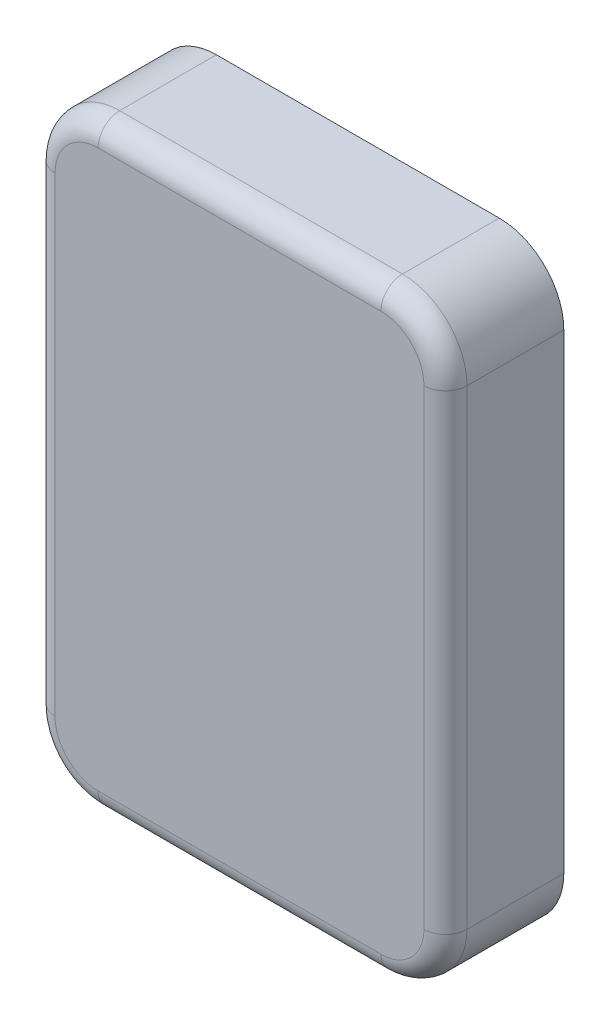
from build123d import *

# Parameters (mm, degrees)
BOSS_EXTRUDE1_DEPTH = 8
SKETCH12_W          = 1.5
SKETCH12_H          = 8.6
BOSS_EXTRUDE8_DEPTH = 3
BOSS_EXTRUDE5_DEPTH = 3
BOSS_EXTRUDE6_START = 8.75
SKETCH10_R          = 1.75
BOSS_EXTRUDE6_DEPTH = 8.75
SKETCH11_W          = 14.1
SKETCH11_H          = 1.5
BOSS_EXTRUDE7_DEPTH = 1.5
FILLET1_R           = 2
CUT_EXTRUDE2_REACH  = 69.432
SKETCH13_W          = 14
SKETCH13_H          = 7.25
FILLET2_R           = 1
SKETCH14_W          = 11
SKETCH14_H          = 52.76
CUT_EXTRUDE3_DEPTH  = 1
SKETCH15_W          = 5.5
SKETCH15_H          = 50.26
CUT_EXTRUDE4_DEPTH  = 1.5
SKETCH17_W          = 4
SKETCH17_H          = 5
SKETCH17_R          = 1
BOSS_EXTRUDE9_DEPTH = 1


with BuildPart() as part:
    # Sketch1 → Boss-Extrude1 (new body)
    with BuildSketch(Plane.XY):
        with BuildLine():
            Line((-0.5, 27.44), (-0.5, 0.5))
            ThreePointArc((-0.5, 0.5), (0.818019485, -2.681980515), (4, -4))
            Line((4, -4), (30.29, -4))
            ThreePointArc((30.29, -4), (33.471980515, -2.681980515), (34.79, 0.5))
            Line((34.79, 0.5), (34.79, 44.26))
            ThreePointArc((34.79, 44.26), (33.471980515, 47.441980515), (30.29, 48.76))
            Line((30.29, 48.76), (4, 48.76))
            ThreePointArc((4, 48.76), (0.818019485, 47.441980515), (-0.5, 44.26))
            Line((-0.5, 44.26), (-0.5, 36.04))
            Line((-0.5, 36.04), (-2, 36.04))
            Line((-2, 36.04), (-2, 44.26))
            ThreePointArc((-2, 44.26), (-0.242640687, 48.502640687), (4, 50.26))
            Line((4, 50.26), (30.29, 50.26))
            ThreePointArc((30.29, 50.26), (34.532640687, 48.502640687), (36.29, 44.26))
            Line((36.29, 44.26), (36.29, 0.5))
            ThreePointArc((36.29, 0.5), (34.532640687, -3.742640687), (30.29, -5.5))
            Line((30.29, -5.5), (4, -5.5))
            ThreePointArc((4, -5.5), (-0.242640687, -3.742640687), (-2, 0.5))
            Line((-2, 0.5), (-2, 27.44))
            Line((-2, 27.44), (-0.5, 27.44))
        make_face()
    extrude(amount=BOSS_EXTRUDE1_DEPTH)

    # Sketch12 → Boss-Extrude8 (add)
    with BuildSketch(Plane.XY.offset(8)):
        with Locations((-1.25, 31.74)):
            Rectangle(SKETCH12_W, SKETCH12_H)
    extrude(amount=-BOSS_EXTRUDE8_DEPTH)

    # Sketch8 → Boss-Extrude5 (add)
    with BuildSketch(Plane.XY.offset(8)):
        with BuildLine():
            Line((-2, 44.26), (-2, 0.5))
            ThreePointArc((-2, 0.5), (-0.242640687, -3.742640687), (4, -5.5))
            Line((4, -5.5), (30.29, -5.5))
            ThreePointArc((30.29, -5.5), (34.532640687, -3.742640687), (36.29, 0.5))
            Line((36.29, 0.5), (36.29, 44.26))
            ThreePointArc((36.29, 44.26), (34.532640687, 48.502640687), (30.29, 50.26))
            Line((30.29, 50.26), (4, 50.26))
            ThreePointArc((4, 50.26), (-0.242640687, 48.502640687), (-2, 44.26))
        make_face()
    extrude(amount=BOSS_EXTRUDE5_DEPTH)

    # Sketch10 → Boss-Extrude6 (add)
    # profile 1 of 4: a face of its own
    with BuildSketch(Plane(origin=(0, 0, 8), x_dir=(-1, 0, 0), z_dir=(0, 0, -1)).offset(BOSS_EXTRUDE6_START)):
        with BuildLine():
            Line((-30.29, 48.76), (-26.73, 48.76))
            Line((-26.73, 48.76), (-26.73, 44.45))
            ThreePointArc((-26.73, 44.45), (-27.828349571, 41.798349571), (-30.48, 40.7))
            Line((-30.48, 40.7), (-34.79, 40.7))
            Line((-34.79, 40.7), (-34.79, 44.26))
            ThreePointArc((-34.79, 44.26), (-33.471980515, 47.441980515), (-30.29, 48.76))
        make_face()
        with Locations(Location((-30.48, 44.45, 0), (0, 0, 180))):
            Circle(SKETCH10_R, mode=Mode.SUBTRACT)
    # profile 2 of 4: a face of its own
    with BuildSketch(Plane(origin=(0, 0, 8), x_dir=(-1, 0, 0), z_dir=(0, 0, -1)).offset(BOSS_EXTRUDE6_START)):
        with BuildLine():
            Line((-3.81, 40.7), (0.5, 40.7))
            Line((0.5, 40.7), (0.5, 44.26))
            ThreePointArc((0.5, 44.26), (-0.818019485, 47.441980515), (-4, 48.76))
            Line((-4, 48.76), (-7.56, 48.76))
            Line((-7.56, 48.76), (-7.56, 44.45))
            ThreePointArc((-7.56, 44.45), (-6.461650429, 41.798349571), (-3.81, 40.7))
        make_face()
        with Locations(Location((-3.81, 44.45, 0), (0, 0, 180))):
            Circle(SKETCH10_R, mode=Mode.SUBTRACT)
    # profile 3 of 4: a face of its own
    with BuildSketch(Plane(origin=(0, 0, 8), x_dir=(-1, 0, 0), z_dir=(0, 0, -1)).offset(BOSS_EXTRUDE6_START)):
        with BuildLine():
            Line((0.5, 7.56), (0.5, 0.5))
            ThreePointArc((0.5, 0.5), (-0.818019485, -2.681980515), (-4, -4))
            Line((-4, -4), (-7.56, -4))
            Line((-7.56, -4), (-7.56, 3.81))
            ThreePointArc((-7.56, 3.81), (-6.461650429, 6.461650429), (-3.81, 7.56))
            Line((-3.81, 7.56), (0.5, 7.56))
        make_face()
        with Locations(Location((-3.81, 3.81, 0), (0, 0, 180))):
            Circle(SKETCH10_R, mode=Mode.SUBTRACT)
    # profile 4 of 4: a face of its own
    with BuildSketch(Plane(origin=(0, 0, 8), x_dir=(-1, 0, 0), z_dir=(0, 0, -1)).offset(BOSS_EXTRUDE6_START)):
        with BuildLine():
            Line((-26.73, -4), (-30.29, -4))
            ThreePointArc((-30.29, -4), (-33.471980515, -2.681980515), (-34.79, 0.5))
            Line((-34.79, 0.5), (-34.79, 7.56))
            Line((-34.79, 7.56), (-30.48, 7.56))
            ThreePointArc((-30.48, 7.56), (-27.828349571, 6.461650429), (-26.73, 3.81))
            Line((-26.73, 3.81), (-26.73, -4))
        make_face()
        with Locations(Location((-30.48, 3.81, 0), (0, 0, 180))):
            Circle(SKETCH10_R, mode=Mode.SUBTRACT)
    extrude(amount=-BOSS_EXTRUDE6_DEPTH)

    # Sketch11 → Boss-Extrude7 (add)
    with BuildSketch(Plane(origin=(0, 0, 8), x_dir=(-1, 0, 0), z_dir=(0, 0, -1))):
        with Locations((-17.145, -4.75)):
            Rectangle(SKETCH11_W, SKETCH11_H)
    extrude(amount=BOSS_EXTRUDE7_DEPTH)

    # Fillet1
    fillet1_edges = [part.edges().sort_by_distance(p)[0] for p in [
        (17.145, -5.5, 11),
        (36.29, 22.38, 11),
        (34.532640687, 48.502640687, 11),
        (17.145, 50.26, 11),
        (-0.242640687, 48.502640687, 11),
        (-2, 22.38, 11),
        (-0.242640687, -3.742640687, 11),
        (34.532640687, -3.742640687, 11),
    ]]
    fillet(fillet1_edges, radius=FILLET1_R)

    # Sketch13 → Cut-Extrude2 (cut, up to next)
    with BuildSketch(Plane.XZ.offset(5.5), mode=Mode.PRIVATE) as cut_extrude2_sk1:
        with Locations((17.145, 3.625)):
            Rectangle(SKETCH13_W, SKETCH13_H)
    cut_extrude2_tool1 = extrude(cut_extrude2_sk1.sketch, amount=-CUT_EXTRUDE2_REACH, mode=Mode.PRIVATE) & part.part
    add(cut_extrude2_tool1.solids().sort_by_distance((17.145, -5.5, 3.625))[0], mode=Mode.SUBTRACT)

    # Fillet2
    fillet2_edges = [part.edges().sort_by_distance(p)[0] for p in [
        (-1.25, 36.04, 5),
        (-1.25, 27.44, 5),
        (10.145, -4.75, 7.25),
        (24.145, -4.75, 7.25),
    ]]
    fillet(fillet2_edges, radius=FILLET2_R)

    # Sketch14 → Cut-Extrude3 (cut)
    with BuildSketch(Plane(origin=(0, 0, 8), x_dir=(-1, 0, 0), z_dir=(0, 0, -1))):
        with Locations((-17.145, 22.38)):
            Rectangle(SKETCH14_W, SKETCH14_H)
    extrude(amount=-CUT_EXTRUDE3_DEPTH, mode=Mode.SUBTRACT)

    # Sketch15 → Cut-Extrude4 (cut)
    with BuildSketch(Plane(origin=(0, 0, 9), x_dir=(-1, 0, 0), z_dir=(0, 0, -1))):
        with Locations((-15.895, 22.38)):
            Rectangle(SKETCH15_W, SKETCH15_H)
    extrude(amount=-CUT_EXTRUDE4_DEPTH, mode=Mode.SUBTRACT)

    # Sketch17 → Boss-Extrude9 (add)
    # profile 1 of 2: a face of its own
    with BuildSketch(Plane(origin=(0, 0, 9), x_dir=(-1, 0, 0), z_dir=(0, 0, -1))):
        with Locations((-20.645, 9.86)):
            Rectangle(SKETCH17_W, SKETCH17_H)
        with Locations((-20.145, 9.86)):
            Circle(SKETCH17_R, mode=Mode.SUBTRACT)
    # profile 2 of 2: a face of its own
    with BuildSketch(Plane(origin=(0, 0, 9), x_dir=(-1, 0, 0), z_dir=(0, 0, -1))):
        with Locations((-20.645, 35.26)):
            Rectangle(SKETCH17_W, SKETCH17_H)
        with Locations((-20.145, 35.26)):
            Circle(SKETCH17_R, mode=Mode.SUBTRACT)
    extrude(amount=BOSS_EXTRUDE9_DEPTH)


solid = part.part
